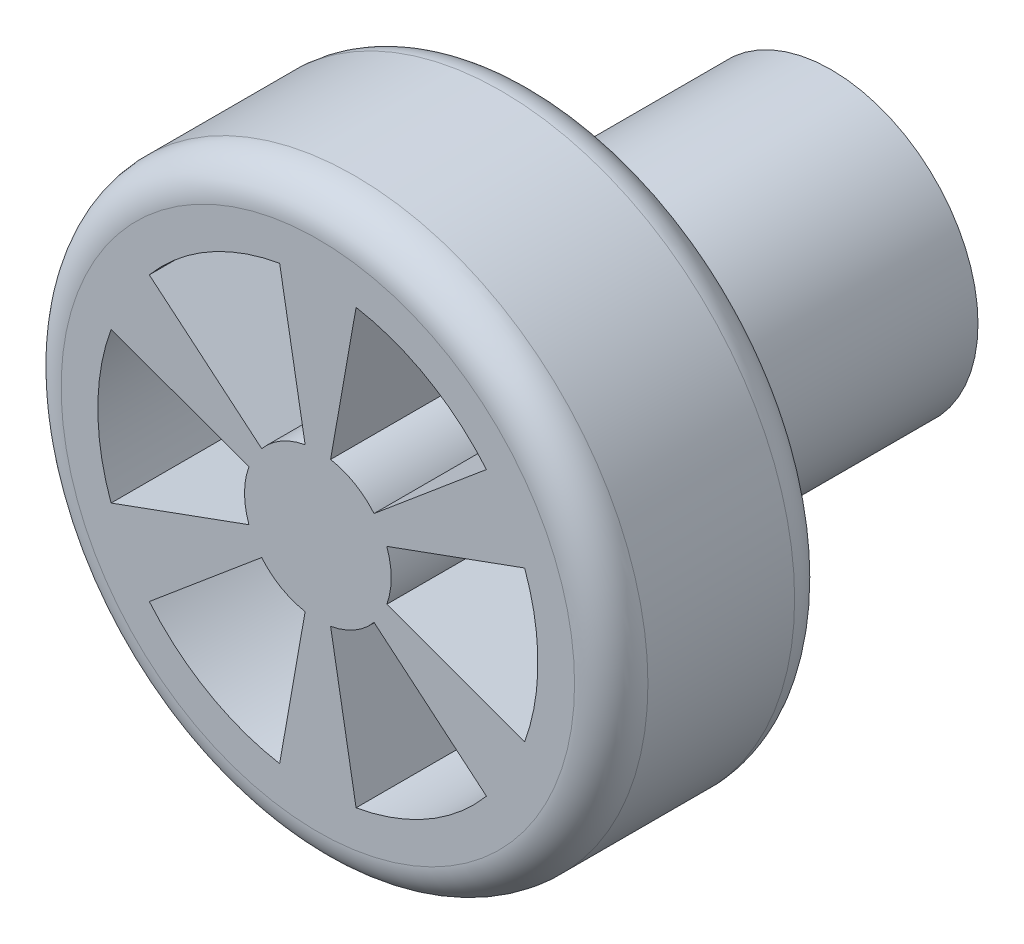
from build123d import *

# Parameters (mm, degrees)
SKETCH1_R           = 101.6
BOSS_EXTRUDE2_DEPTH = 76.2
CUT_EXTRUDE1_REACH  = 164.639
FILLET1_R           = 12.7
SKETCH6_R           = 50.8
BOSS_EXTRUDE4_DEPTH = 101.6


with BuildPart() as part:
    # Sketch1 → Boss-Extrude2 (new body)
    with BuildSketch(Plane.XY):
        with Locations(Location((0, 0, 0), (0, 0, 180))):
            Circle(SKETCH1_R)
    extrude(amount=BOSS_EXTRUDE2_DEPTH)

    # Sketch5 → Cut-Extrude1 (cut, up to next)
    with BuildSketch(Plane(origin=(0, 0, 0), x_dir=(-1, 0, 0), z_dir=(0, 0, -1)), mode=Mode.PRIVATE) as cut_extrude1_sk1:
        with BuildLine():
            Line((23.868192568, 8.68731164), (71.604577704, 26.061934921))
            ThreePointArc((71.604577704, 26.061934921), (76.2, 0), (71.604577704, -26.061934921))
            Line((71.604577704, -26.061934921), (23.868192568, -8.68731164))
            ThreePointArc((23.868192568, -8.68731164), (25.4, 0), (23.868192568, 8.68731164))
        make_face()
    cut_extrude1_tool1 = extrude(cut_extrude1_sk1.sketch, amount=-CUT_EXTRUDE1_REACH, mode=Mode.PRIVATE) & part.part
    # Sketch5 → Cut-Extrude1 (cut, up to next)
    with BuildSketch(Plane(origin=(0, 0, 0), x_dir=(-1, 0, 0), z_dir=(0, 0, -1)), mode=Mode.PRIVATE) as cut_extrude1_sk2:
        with BuildLine():
            Line((19.457528855, -16.326805286), (58.372586566, -48.980415858))
            ThreePointArc((58.372586566, -48.980415858), (38.1, -65.991135768), (13.231991138, -75.04235078))
            Line((13.231991138, -75.04235078), (4.410663713, -25.014116927))
            ThreePointArc((4.410663713, -25.014116927), (12.7, -21.997045256), (19.457528855, -16.326805286))
        make_face()
    cut_extrude1_tool2 = extrude(cut_extrude1_sk2.sketch, amount=-CUT_EXTRUDE1_REACH, mode=Mode.PRIVATE) & part.part
    # Sketch5 → Cut-Extrude1 (cut, up to next)
    with BuildSketch(Plane(origin=(0, 0, 0), x_dir=(-1, 0, 0), z_dir=(0, 0, -1)), mode=Mode.PRIVATE) as cut_extrude1_sk3:
        with BuildLine():
            Line((-4.410663713, -25.014116927), (-13.231991138, -75.04235078))
            ThreePointArc((-13.231991138, -75.04235078), (-38.1, -65.991135768), (-58.372586566, -48.980415858))
            Line((-58.372586566, -48.980415858), (-19.457528855, -16.326805286))
            ThreePointArc((-19.457528855, -16.326805286), (-12.7, -21.997045256), (-4.410663713, -25.014116927))
        make_face()
    cut_extrude1_tool3 = extrude(cut_extrude1_sk3.sketch, amount=-CUT_EXTRUDE1_REACH, mode=Mode.PRIVATE) & part.part
    # Sketch5 → Cut-Extrude1 (cut, up to next)
    with BuildSketch(Plane(origin=(0, 0, 0), x_dir=(-1, 0, 0), z_dir=(0, 0, -1)), mode=Mode.PRIVATE) as cut_extrude1_sk4:
        with BuildLine():
            Line((-23.868192568, -8.68731164), (-71.604577704, -26.061934921))
            ThreePointArc((-71.604577704, -26.061934921), (-76.2, 0), (-71.604577704, 26.061934921))
            Line((-71.604577704, 26.061934921), (-23.868192568, 8.68731164))
            ThreePointArc((-23.868192568, 8.68731164), (-25.4, 0), (-23.868192568, -8.68731164))
        make_face()
    cut_extrude1_tool4 = extrude(cut_extrude1_sk4.sketch, amount=-CUT_EXTRUDE1_REACH, mode=Mode.PRIVATE) & part.part
    # Sketch5 → Cut-Extrude1 (cut, up to next)
    with BuildSketch(Plane(origin=(0, 0, 0), x_dir=(-1, 0, 0), z_dir=(0, 0, -1)), mode=Mode.PRIVATE) as cut_extrude1_sk5:
        with BuildLine():
            Line((-19.457528855, 16.326805286), (-58.372586566, 48.980415858))
            ThreePointArc((-58.372586566, 48.980415858), (-38.1, 65.991135768), (-13.231991138, 75.04235078))
            Line((-13.231991138, 75.04235078), (-4.410663713, 25.014116927))
            ThreePointArc((-4.410663713, 25.014116927), (-12.7, 21.997045256), (-19.457528855, 16.326805286))
        make_face()
    cut_extrude1_tool5 = extrude(cut_extrude1_sk5.sketch, amount=-CUT_EXTRUDE1_REACH, mode=Mode.PRIVATE) & part.part
    # Sketch5 → Cut-Extrude1 (cut, up to next)
    with BuildSketch(Plane(origin=(0, 0, 0), x_dir=(-1, 0, 0), z_dir=(0, 0, -1)), mode=Mode.PRIVATE) as cut_extrude1_sk6:
        with BuildLine():
            Line((4.410663713, 25.014116927), (13.231991138, 75.04235078))
            ThreePointArc((13.231991138, 75.04235078), (38.1, 65.991135768), (58.372586566, 48.980415858))
            Line((58.372586566, 48.980415858), (19.457528855, 16.326805286))
            ThreePointArc((19.457528855, 16.326805286), (12.7, 21.997045256), (4.410663713, 25.014116927))
        make_face()
    cut_extrude1_tool6 = extrude(cut_extrude1_sk6.sketch, amount=-CUT_EXTRUDE1_REACH, mode=Mode.PRIVATE) & part.part
    add(cut_extrude1_tool1.solids().sort_by_distance((-53.922515, 0, 0))[0], mode=Mode.SUBTRACT)
    add(cut_extrude1_tool2.solids().sort_by_distance((-26.961258, -46.698268, 0))[0], mode=Mode.SUBTRACT)
    add(cut_extrude1_tool3.solids().sort_by_distance((26.961258, -46.698268, 0))[0], mode=Mode.SUBTRACT)
    add(cut_extrude1_tool4.solids().sort_by_distance((53.922515, 0, 0))[0], mode=Mode.SUBTRACT)
    add(cut_extrude1_tool5.solids().sort_by_distance((26.961258, 46.698268, 0))[0], mode=Mode.SUBTRACT)
    add(cut_extrude1_tool6.solids().sort_by_distance((-26.961258, 46.698268, 0))[0], mode=Mode.SUBTRACT)

    # Fillet1
    fillet1_edges = [part.edges().sort_by_distance(p)[0] for p in [
        (101.6, 0, 0),
        (101.6, 0, 76.2),
    ]]
    fillet(fillet1_edges, radius=FILLET1_R)


with BuildPart() as body_2:
    # Sketch6 → Boss-Extrude4 (new body)
    with BuildSketch(Plane(origin=(0, 0, 0), x_dir=(-1, 0, 0), z_dir=(0, 0, -1))):
        Circle(SKETCH6_R)
    extrude(amount=BOSS_EXTRUDE4_DEPTH)


solid = Compound([part.part, body_2.part])
